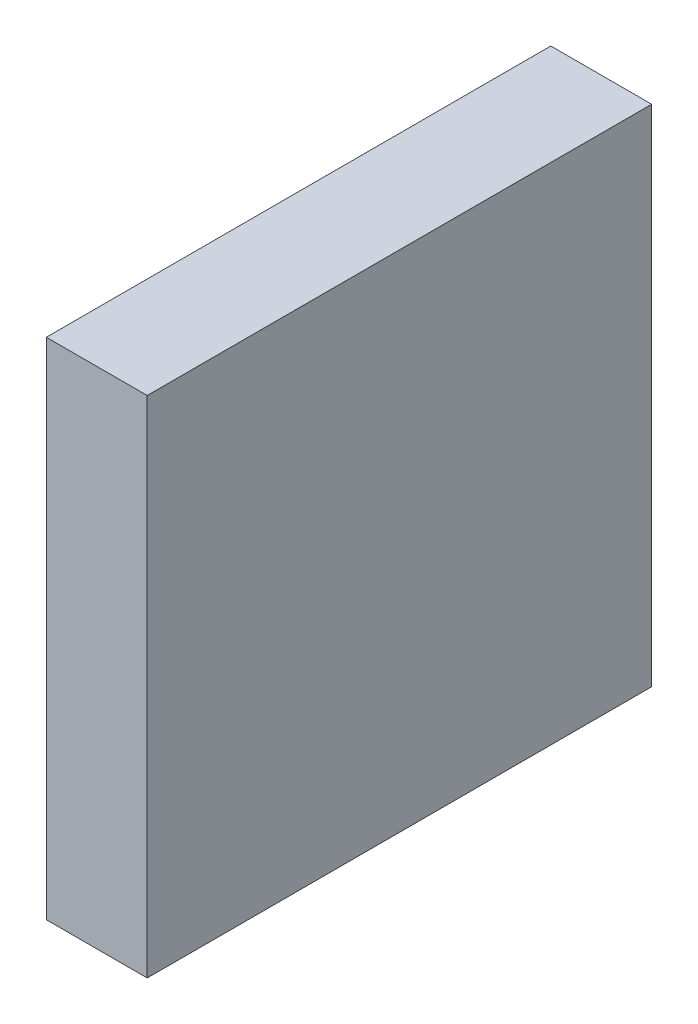
from build123d import *

# Parameters (mm, degrees)
SKETCH1_W           = 1
SKETCH1_H           = 5
BOSS_EXTRUDE1_DEPTH = 5


with BuildPart() as part:
    # Sketch1 → Boss-Extrude1 (new body)
    with BuildSketch(Plane.XY):
        with Locations((0.5, 2.5)):
            Rectangle(SKETCH1_W, SKETCH1_H)
    extrude(amount=BOSS_EXTRUDE1_DEPTH)


solid = part.part
